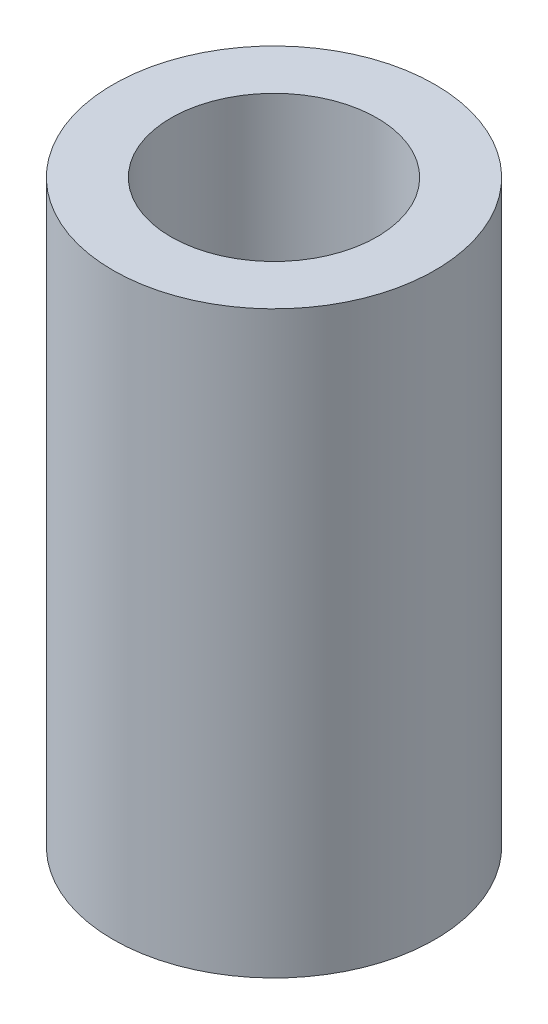
from build123d import *

# Parameters (mm, degrees)
SKETCH_1_R      = 2.5
SKETCH_1_R_2    = 1.6
EXTRUDE_1_DEPTH = 9


with BuildPart() as part:
    # ｽｹｯﾁ1 → ﾎﾞｽ - 押し出し1 (new body)
    with BuildSketch(Plane(origin=(0, 0, 0), x_dir=(1, 0, 0), z_dir=(0, 1, 0))):
        with Locations(Location((0, 0, 0), (0, 0, 270))):
            Circle(SKETCH_1_R)
        with Locations(Location((0, 0, 0), (0, 0, 270))):
            Circle(SKETCH_1_R_2, mode=Mode.SUBTRACT)
    extrude(amount=EXTRUDE_1_DEPTH)


solid = part.part
